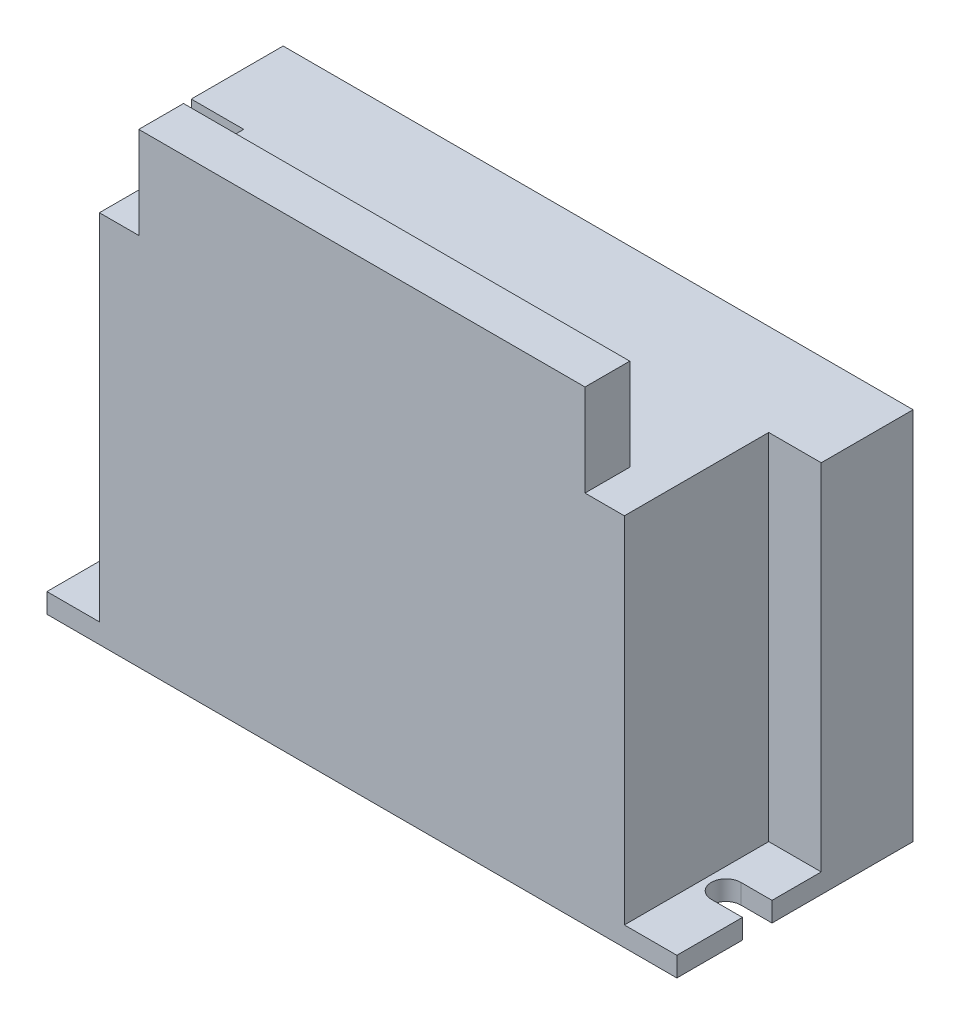
from build123d import *

# Parameters (mm, degrees)
SKETCH_1_W          = 96
SKETCH_1_H          = 57
EXTRUDE_1_DEPTH     = 36
SKETCH_2_W          = 8
SKETCH_2_H          = 22
CUT_EXTRUDE_1_DEPTH = 54
CUT_EXTRUDE_2_DEPTH = 54
SKETCH_5_W          = 68
SKETCH_5_H          = 6.822468225
EXTRUDE_2_DEPTH     = 14


with BuildPart() as part:
    # 스케치1 → 보스-돌출1 (new body)
    with BuildSketch(Plane.XY):
        Rectangle(SKETCH_1_W, SKETCH_1_H)
    extrude(amount=EXTRUDE_1_DEPTH)

    # 스케치2 → 컷-돌출1 (cut)
    with BuildSketch(Plane(origin=(0, 28.5, 0), x_dir=(1, 0, 0), z_dir=(0, 1, 0))):
        with Locations((-44, -25)):
            Rectangle(SKETCH_2_W, SKETCH_2_H)
        with Locations((44, -25)):
            Rectangle(SKETCH_2_W, SKETCH_2_H)
    extrude(amount=-CUT_EXTRUDE_1_DEPTH, mode=Mode.SUBTRACT)

    # 스케치4 → 컷-돌출2 (cut)
    with BuildSketch(Plane(origin=(0, -25.5, 0), x_dir=(1, 0, 0), z_dir=(0, 1, 0))):
        with BuildLine():
            Line((48, -26), (43.25, -26))
            ThreePointArc((43.25, -26), (41, -23.75), (43.25, -21.5))
            Line((43.25, -21.5), (48, -21.5))
            Line((48, -21.5), (48, -26))
        make_face()
    cut_extrude_2 = extrude(amount=-CUT_EXTRUDE_2_DEPTH, mode=Mode.SUBTRACT)

    # 대칭 복사1: 컷-돌출2 across plane
    add(cut_extrude_2.mirror(Plane(origin=(0, 0, 0), x_dir=(0, 0, 1), z_dir=(1, 0, 0))), mode=Mode.SUBTRACT)

    # 스케치5 → 보스-돌출2 (add)
    with BuildSketch(Plane(origin=(0, 28.5, 0), x_dir=(1, 0, 0), z_dir=(0, 1, 0))):
        with Locations((0, -32.588765888)):
            Rectangle(SKETCH_5_W, SKETCH_5_H)
    extrude(amount=EXTRUDE_2_DEPTH)


solid = part.part
